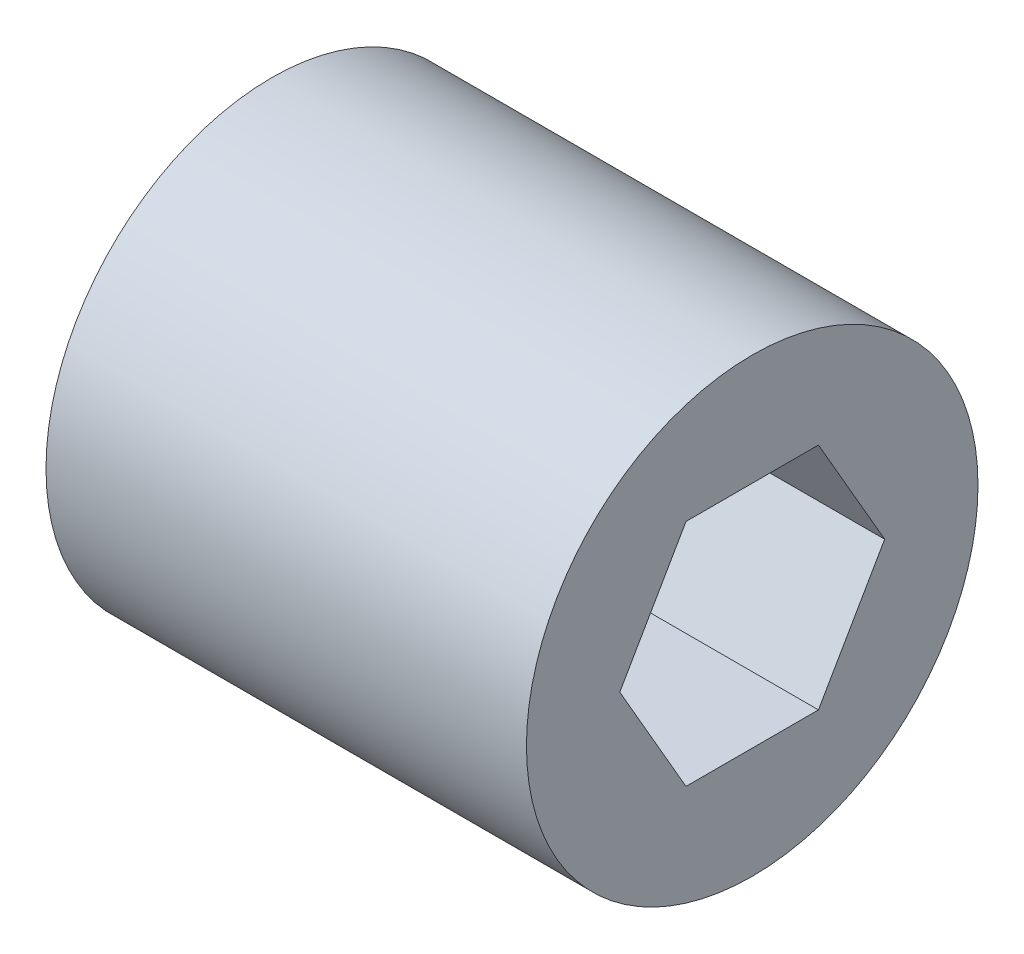
from build123d import *

# Parameters (mm, degrees)
CROQUIS1_R              = 12.5
SALIENTE_EXTRUIR1_DEPTH = 26.6


with BuildPart() as part:
    # Croquis1 → Saliente-Extruir1 (new body)
    with BuildSketch(Plane(origin=(0, 0, 0), x_dir=(0, 0, -1), z_dir=(1, 0, 0))):
        Circle(CROQUIS1_R)
        Polygon((7.332348419, 0), (3.666174209, 6.35), (-3.666174209, 6.35), (-7.332348419, 0), (-3.666174209, -6.35), (3.666174209, -6.35), align=None, mode=Mode.SUBTRACT)
    extrude(amount=SALIENTE_EXTRUIR1_DEPTH)


solid = part.part
